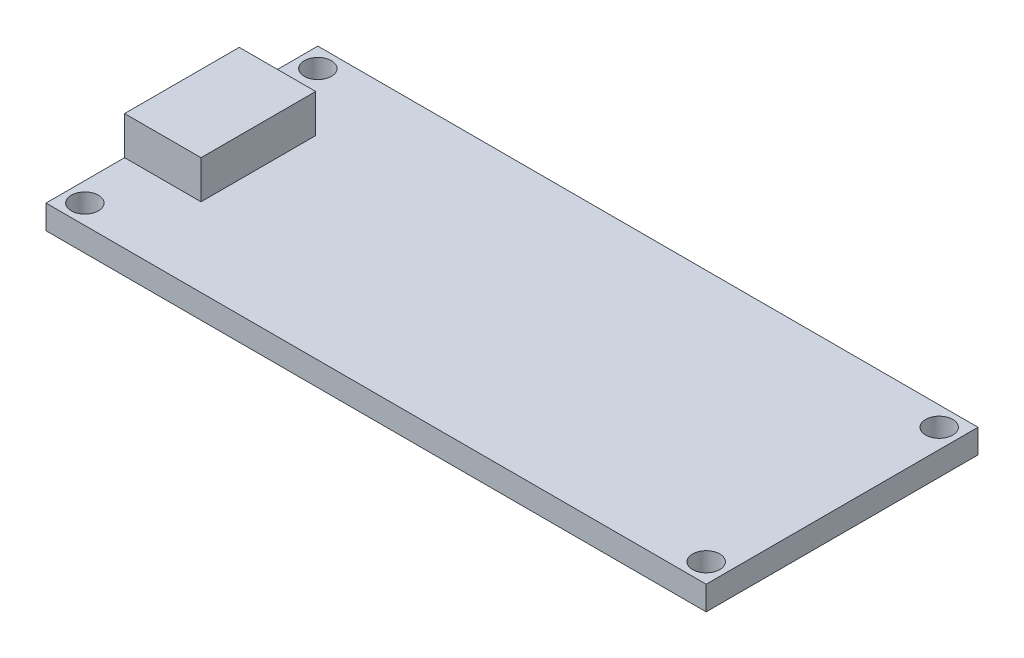
from build123d import *

# Parameters (mm, degrees)
SKETCH1_W           = 43.18
SKETCH1_H           = 17.78
SKETCH1_R           = 0.889
BOSS_EXTRUDE1_DEPTH = 1.57
SKETCH2_W           = 5
SKETCH2_H           = 3.75
BOSS_EXTRUDE2_DEPTH = 2.5


with BuildPart() as part:
    # Sketch1 → Boss-Extrude1 (new body)
    with BuildSketch(Plane(origin=(0, 0, 0), x_dir=(1, 0, 0), z_dir=(0, 1, 0))):
        with Locations((-17.071162791, 9.812965116)):
            Rectangle(SKETCH1_W, SKETCH1_H)
        with Locations(Location((-37.391162791, 17.432965116, 0), (0, 0, 270))):
            Circle(SKETCH1_R, mode=Mode.SUBTRACT)
        with Locations(Location((-37.391162791, 2.192965116, 0), (0, 0, 270))):
            Circle(SKETCH1_R, mode=Mode.SUBTRACT)
        with Locations(Location((3.248837209, 2.192965116, 0), (0, 0, 270))):
            Circle(SKETCH1_R, mode=Mode.SUBTRACT)
        with Locations(Location((3.248837209, 17.432965116, 0), (0, 0, 270))):
            Circle(SKETCH1_R, mode=Mode.SUBTRACT)
    extrude(amount=BOSS_EXTRUDE1_DEPTH)

    # Sketch2 → Boss-Extrude2 (add)
    with BuildSketch(Plane(origin=(0, 1.57, 0), x_dir=(1, 0, 0), z_dir=(0, 1, 0))):
        with Locations((-36.161162791, 11.687965116)):
            Rectangle(SKETCH2_W, SKETCH2_H)
        with Locations((-36.161162791, 7.937965116)):
            Rectangle(SKETCH2_W, SKETCH2_H)
    extrude(amount=BOSS_EXTRUDE2_DEPTH)


solid = part.part
